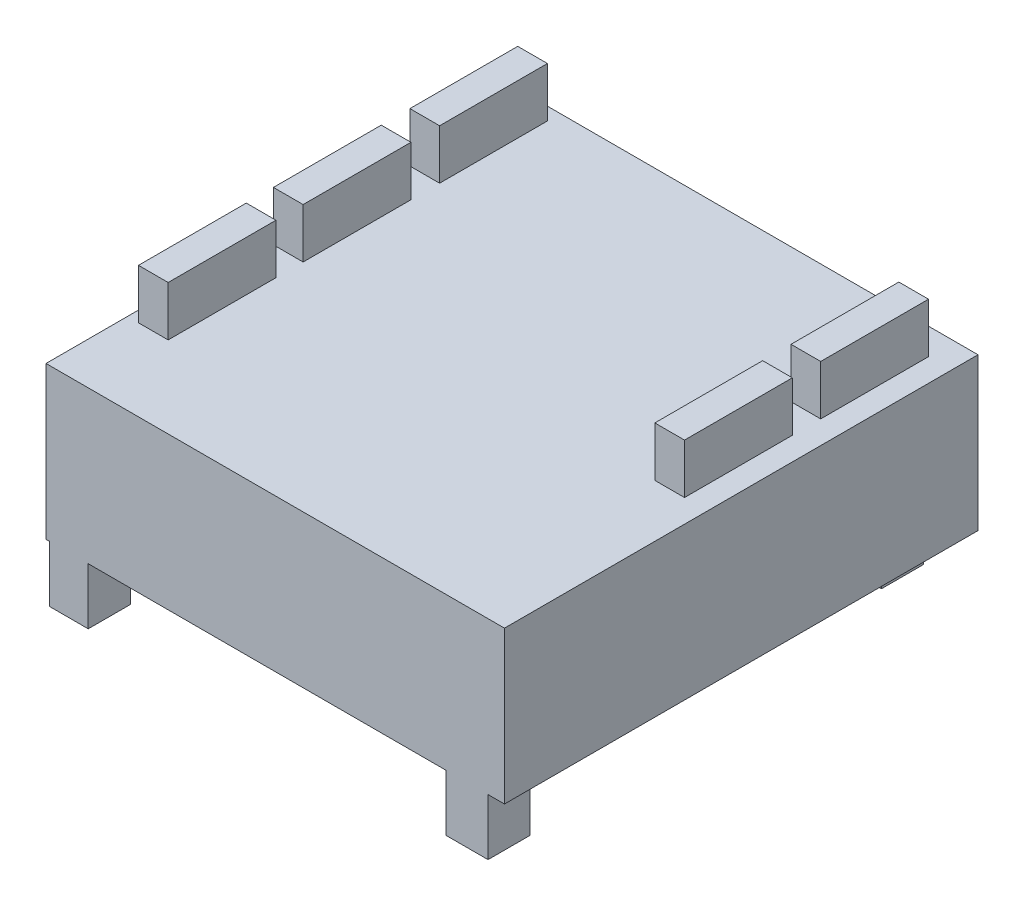
from build123d import *

# Parameters (mm, degrees)
SKETCH1_W           = 77.216
SKETCH1_H           = 79.756
BASE_DEPTH          = 25.654
SKETCH2_W           = 5.0038
SKETCH2_H           = 18.161
TOP_HEADERS_DEPTH   = 8.382
SKETCH3_W           = 7.112
SKETCH3_H           = 7.112
SKETCH3_W_2         = 6.5278
BOSS_EXTRUDE3_DEPTH = 9.4996


with BuildPart() as part:
    # Sketch1 → Base (new body)
    with BuildSketch(Plane(origin=(0, 0, 0), x_dir=(1, 0, 0), z_dir=(0, 1, 0))):
        with Locations((38.608, 39.878)):
            Rectangle(SKETCH1_W, SKETCH1_H)
    extrude(amount=BASE_DEPTH)

    # Sketch2 → Top Headers (add)
    with BuildSketch(Plane(origin=(0, 25.654, 0), x_dir=(1, 0, 0), z_dir=(0, 1, 0))):
        with Locations((4.3561, 68.5165)):
            Rectangle(SKETCH2_W, SKETCH2_H)
        with Locations((4.3561, 45.5295)):
            Rectangle(SKETCH2_W, SKETCH2_H)
        with Locations((4.3561, 22.7965)):
            Rectangle(SKETCH2_W, SKETCH2_H)
        with Locations((70.8279, 66.2305)):
            Rectangle(SKETCH2_W, SKETCH2_H)
        with Locations((70.8279, 43.2943)):
            Rectangle(SKETCH2_W, SKETCH2_H)
    extrude(amount=TOP_HEADERS_DEPTH)

    # Sketch3 → Boss-Extrude3 (add)
    with BuildSketch(Plane.XZ):
        with Locations((64.516, -76.2)):
            Rectangle(SKETCH3_W, SKETCH3_H)
        with Locations((9.652, -76.2)):
            Rectangle(SKETCH3_W, SKETCH3_H)
        with Locations((3.8481, -3.556)):
            Rectangle(SKETCH3_W_2, SKETCH3_H)
        with Locations((70.8914, -3.556)):
            Rectangle(SKETCH3_W, SKETCH3_H)
    extrude(amount=BOSS_EXTRUDE3_DEPTH)


solid = part.part
